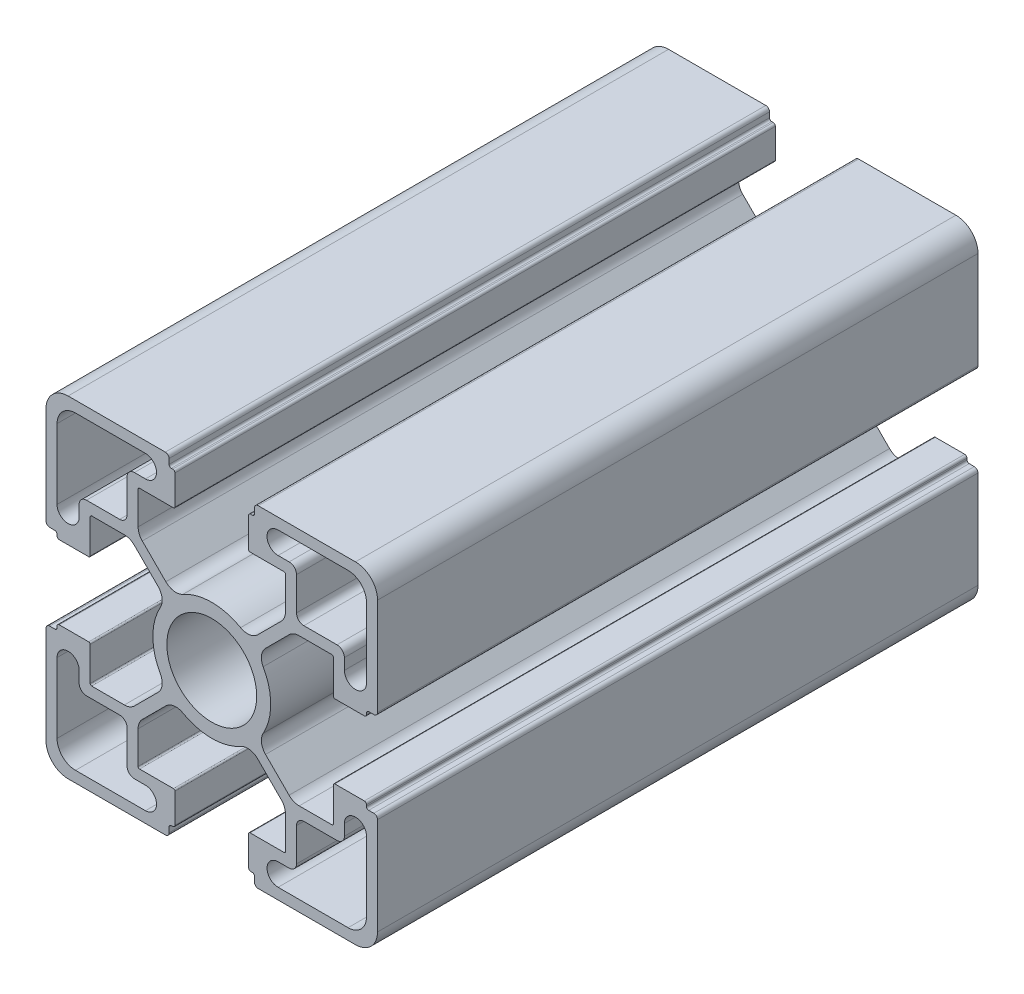
from build123d import *

# Parameters (mm, degrees)
BOSS_EXTRUDE1_DEPTH = 81.495816185
SCALE1_SCALE        = 0.5644444


with BuildPart() as part:
    # Sketch1 → Boss-Extrude1 (new body)
    with BuildSketch(Plane.XY):
        with BuildLine():
            Line((-22.5, 19.5), (-22.5, 6.3))
            ThreePointArc((-22.5, 6.3), (-22.353553391, 5.946446609), (-22, 5.8))
            Line((-22, 5.8), (-21.3, 5.8))
            ThreePointArc((-21.3, 5.8), (-21.087867966, 5.712132034), (-21, 5.5))
            Line((-21, 5.5), (-21, 5.3))
            ThreePointArc((-21, 5.3), (-20.912132034, 5.087867966), (-20.7, 5))
            Line((-20.7, 5), (-16.7, 5))
            ThreePointArc((-16.7, 5), (-16.558578644, 5.058578644), (-16.5, 5.2))
            Line((-16.5, 5.2), (-16.5, 9.8))
            ThreePointArc((-16.5, 9.8), (-16.441421356, 9.941421356), (-16.3, 10))
            Line((-16.3, 10), (-11.864234483, 10))
            ThreePointArc((-11.864234483, 10), (-11.121828624, 9.852326293), (-10.492447327, 9.431787156))
            Line((-10.492447327, 9.431787156), (-7.296699127, 6.236038955))
            ThreePointArc((-7.296699127, 6.236038955), (-6.746669172, 5.129240469), (-6.976648919, 3.914890784))
            ThreePointArc((-6.976648919, 3.914890784), (-7.739935121, 2.023216331), (-8, 0))
            ThreePointArc((-8, 0), (-7.739935121, -2.023216331), (-6.976648919, -3.914890784))
            ThreePointArc((-6.976648919, -3.914890784), (-6.746669172, -5.129240469), (-7.296699127, -6.236038955))
            Line((-7.296699127, -6.236038955), (-10.492447327, -9.431787156))
            ThreePointArc((-10.492447327, -9.431787156), (-11.121828624, -9.852326293), (-11.864234483, -10))
            Line((-11.864234483, -10), (-16.3, -10))
            ThreePointArc((-16.3, -10), (-16.441421356, -9.941421356), (-16.5, -9.8))
            Line((-16.5, -9.8), (-16.5, -5.2))
            ThreePointArc((-16.5, -5.2), (-16.558578644, -5.058578644), (-16.7, -5))
            Line((-16.7, -5), (-20.7, -5))
            ThreePointArc((-20.7, -5), (-20.912132034, -5.087867966), (-21, -5.3))
            Line((-21, -5.3), (-21, -5.5))
            ThreePointArc((-21, -5.5), (-21.087867966, -5.712132034), (-21.3, -5.8))
            Line((-21.3, -5.8), (-22, -5.8))
            ThreePointArc((-22, -5.8), (-22.353553391, -5.946446609), (-22.5, -6.3))
            Line((-22.5, -6.3), (-22.5, -19.5))
            ThreePointArc((-22.5, -19.5), (-21.621320344, -21.621320344), (-19.5, -22.5))
            Line((-19.5, -22.5), (-6.3, -22.5))
            ThreePointArc((-6.3, -22.5), (-5.946446609, -22.353553391), (-5.8, -22))
            Line((-5.8, -22), (-5.8, -21.3))
            ThreePointArc((-5.8, -21.3), (-5.712132034, -21.087867966), (-5.5, -21))
            Line((-5.5, -21), (-5.3, -21))
            ThreePointArc((-5.3, -21), (-5.087867966, -20.912132034), (-5, -20.7))
            Line((-5, -20.7), (-5, -16.7))
            ThreePointArc((-5, -16.7), (-5.058578644, -16.558578644), (-5.2, -16.5))
            Line((-5.2, -16.5), (-9.8, -16.5))
            ThreePointArc((-9.8, -16.5), (-9.941421356, -16.441421356), (-10, -16.3))
            Line((-10, -16.3), (-10, -11.864234483))
            ThreePointArc((-10, -11.864234483), (-9.852326293, -11.121828624), (-9.431787156, -10.492447327))
            Line((-9.431787156, -10.492447327), (-6.236038955, -7.296699127))
            ThreePointArc((-6.236038955, -7.296699127), (-5.129240469, -6.746669172), (-3.914890784, -6.976648919))
            ThreePointArc((-3.914890784, -6.976648919), (-2.023216331, -7.739935121), (0, -8))
            ThreePointArc((0, -8), (2.023216331, -7.739935121), (3.914890784, -6.976648919))
            ThreePointArc((3.914890784, -6.976648919), (5.129240469, -6.746669172), (6.236038955, -7.296699127))
            Line((6.236038955, -7.296699127), (9.431787156, -10.492447327))
            ThreePointArc((9.431787156, -10.492447327), (9.852326293, -11.121828624), (10, -11.864234483))
            Line((10, -11.864234483), (10, -16.3))
            ThreePointArc((10, -16.3), (9.941421356, -16.441421356), (9.8, -16.5))
            Line((9.8, -16.5), (5.2, -16.5))
            ThreePointArc((5.2, -16.5), (5.058578644, -16.558578644), (5, -16.7))
            Line((5, -16.7), (5, -20.7))
            ThreePointArc((5, -20.7), (5.087867966, -20.912132034), (5.3, -21))
            Line((5.3, -21), (5.5, -21))
            ThreePointArc((5.5, -21), (5.712132034, -21.087867966), (5.8, -21.3))
            Line((5.8, -21.3), (5.8, -22))
            ThreePointArc((5.8, -22), (5.946446609, -22.353553391), (6.3, -22.5))
            Line((6.3, -22.5), (19.5, -22.5))
            ThreePointArc((19.5, -22.5), (21.621320344, -21.621320344), (22.5, -19.5))
            Line((22.5, -19.5), (22.5, -6.3))
            ThreePointArc((22.5, -6.3), (22.353553391, -5.946446609), (22, -5.8))
            Line((22, -5.8), (21.3, -5.8))
            ThreePointArc((21.3, -5.8), (21.087867966, -5.712132034), (21, -5.5))
            Line((21, -5.5), (21, -5.3))
            ThreePointArc((21, -5.3), (20.912132034, -5.087867966), (20.7, -5))
            Line((20.7, -5), (16.7, -5))
            ThreePointArc((16.7, -5), (16.558578644, -5.058578644), (16.5, -5.2))
            Line((16.5, -5.2), (16.5, -9.8))
            ThreePointArc((16.5, -9.8), (16.441421356, -9.941421356), (16.3, -10))
            Line((16.3, -10), (11.864234483, -10))
            ThreePointArc((11.864234483, -10), (11.121828624, -9.852326293), (10.492447327, -9.431787156))
            Line((10.492447327, -9.431787156), (7.296699127, -6.236038955))
            ThreePointArc((7.296699127, -6.236038955), (6.746669172, -5.129240469), (6.976648919, -3.914890784))
            ThreePointArc((6.976648919, -3.914890784), (7.739935121, -2.023216331), (8, 0))
            ThreePointArc((8, 0), (7.739935121, 2.023216331), (6.976648919, 3.914890784))
            ThreePointArc((6.976648919, 3.914890784), (6.746669172, 5.129240469), (7.296699127, 6.236038955))
            Line((7.296699127, 6.236038955), (10.492447327, 9.431787156))
            ThreePointArc((10.492447327, 9.431787156), (11.121828624, 9.852326293), (11.864234483, 10))
            Line((11.864234483, 10), (16.3, 10))
            ThreePointArc((16.3, 10), (16.441421356, 9.941421356), (16.5, 9.8))
            Line((16.5, 9.8), (16.5, 5.2))
            ThreePointArc((16.5, 5.2), (16.558578644, 5.058578644), (16.7, 5))
            Line((16.7, 5), (20.7, 5))
            ThreePointArc((20.7, 5), (20.912132034, 5.087867966), (21, 5.3))
            Line((21, 5.3), (21, 5.5))
            ThreePointArc((21, 5.5), (21.087867966, 5.712132034), (21.3, 5.8))
            Line((21.3, 5.8), (22, 5.8))
            ThreePointArc((22, 5.8), (22.353553391, 5.946446609), (22.5, 6.3))
            Line((22.5, 6.3), (22.5, 19.5))
            ThreePointArc((22.5, 19.5), (21.621320344, 21.621320344), (19.5, 22.5))
            Line((19.5, 22.5), (6.3, 22.5))
            ThreePointArc((6.3, 22.5), (5.946446609, 22.353553391), (5.8, 22))
            Line((5.8, 22), (5.8, 21.3))
            ThreePointArc((5.8, 21.3), (5.712132034, 21.087867966), (5.5, 21))
            Line((5.5, 21), (5.3, 21))
            ThreePointArc((5.3, 21), (5.087867966, 20.912132034), (5, 20.7))
            Line((5, 20.7), (5, 16.7))
            ThreePointArc((5, 16.7), (5.058578644, 16.558578644), (5.2, 16.5))
            Line((5.2, 16.5), (9.8, 16.5))
            ThreePointArc((9.8, 16.5), (9.941421356, 16.441421356), (10, 16.3))
            Line((10, 16.3), (10, 11.864234483))
            ThreePointArc((10, 11.864234483), (9.852326293, 11.121828624), (9.431787156, 10.492447327))
            Line((9.431787156, 10.492447327), (6.236038955, 7.296699127))
            ThreePointArc((6.236038955, 7.296699127), (5.129240469, 6.746669172), (3.914890784, 6.976648919))
            ThreePointArc((3.914890784, 6.976648919), (2.023216331, 7.739935121), (0, 8))
            ThreePointArc((0, 8), (-2.023216331, 7.739935121), (-3.914890784, 6.976648919))
            ThreePointArc((-3.914890784, 6.976648919), (-5.129240469, 6.746669172), (-6.236038955, 7.296699127))
            Line((-6.236038955, 7.296699127), (-9.431787156, 10.492447327))
            ThreePointArc((-9.431787156, 10.492447327), (-9.852326293, 11.121828624), (-10, 11.864234483))
            Line((-10, 11.864234483), (-10, 16.3))
            ThreePointArc((-10, 16.3), (-9.941421356, 16.441421356), (-9.8, 16.5))
            Line((-9.8, 16.5), (-5.2, 16.5))
            ThreePointArc((-5.2, 16.5), (-5.058578644, 16.558578644), (-5, 16.7))
            Line((-5, 16.7), (-5, 20.7))
            ThreePointArc((-5, 20.7), (-5.087867966, 20.912132034), (-5.3, 21))
            Line((-5.3, 21), (-5.5, 21))
            ThreePointArc((-5.5, 21), (-5.712132034, 21.087867966), (-5.8, 21.3))
            Line((-5.8, 21.3), (-5.8, 22))
            ThreePointArc((-5.8, 22), (-5.946446609, 22.353553391), (-6.3, 22.5))
            Line((-6.3, 22.5), (-19.5, 22.5))
            ThreePointArc((-19.5, 22.5), (-21.621320344, 21.621320344), (-22.5, 19.5))
        make_face()
        with BuildLine():
            Line((-21, 18.5), (-21, 9))
            ThreePointArc((-21, 9), (-19.5, 7.5), (-18, 9))
            Line((-18, 9), (-18, 10.5))
            ThreePointArc((-18, 10.5), (-17.707106781, 11.207106781), (-17, 11.5))
            Line((-17, 11.5), (-12.5, 11.5))
            ThreePointArc((-12.5, 11.5), (-11.792893219, 11.792893219), (-11.5, 12.5))
            Line((-11.5, 12.5), (-11.5, 17))
            ThreePointArc((-11.5, 17), (-11.207106781, 17.707106781), (-10.5, 18))
            Line((-10.5, 18), (-9, 18))
            ThreePointArc((-9, 18), (-7.5, 19.5), (-9, 21))
            Line((-9, 21), (-18.5, 21))
            ThreePointArc((-18.5, 21), (-20.267766953, 20.267766953), (-21, 18.5))
        make_face(mode=Mode.SUBTRACT)
        with BuildLine():
            Line((18.5, 21), (9, 21))
            ThreePointArc((9, 21), (7.5, 19.5), (9, 18))
            Line((9, 18), (10.5, 18))
            ThreePointArc((10.5, 18), (11.207106781, 17.707106781), (11.5, 17))
            Line((11.5, 17), (11.5, 12.5))
            ThreePointArc((11.5, 12.5), (11.792893219, 11.792893219), (12.5, 11.5))
            Line((12.5, 11.5), (17, 11.5))
            ThreePointArc((17, 11.5), (17.707106781, 11.207106781), (18, 10.5))
            Line((18, 10.5), (18, 9))
            ThreePointArc((18, 9), (19.5, 7.5), (21, 9))
            Line((21, 9), (21, 18.5))
            ThreePointArc((21, 18.5), (20.267766953, 20.267766953), (18.5, 21))
        make_face(mode=Mode.SUBTRACT)
        with BuildLine():
            Line((21, -18.5), (21, -9))
            ThreePointArc((21, -9), (19.5, -7.5), (18, -9))
            Line((18, -9), (18, -10.5))
            ThreePointArc((18, -10.5), (17.707106781, -11.207106781), (17, -11.5))
            Line((17, -11.5), (12.5, -11.5))
            ThreePointArc((12.5, -11.5), (11.792893219, -11.792893219), (11.5, -12.5))
            Line((11.5, -12.5), (11.5, -17))
            ThreePointArc((11.5, -17), (11.207106781, -17.707106781), (10.5, -18))
            Line((10.5, -18), (9, -18))
            ThreePointArc((9, -18), (7.5, -19.5), (9, -21))
            Line((9, -21), (18.5, -21))
            ThreePointArc((18.5, -21), (20.267766953, -20.267766953), (21, -18.5))
        make_face(mode=Mode.SUBTRACT)
        with BuildLine():
            Line((-18.5, -21), (-9, -21))
            ThreePointArc((-9, -21), (-7.5, -19.5), (-9, -18))
            Line((-9, -18), (-10.5, -18))
            ThreePointArc((-10.5, -18), (-11.207106781, -17.707106781), (-11.5, -17))
            Line((-11.5, -17), (-11.5, -12.5))
            ThreePointArc((-11.5, -12.5), (-11.792893219, -11.792893219), (-12.5, -11.5))
            Line((-12.5, -11.5), (-17, -11.5))
            ThreePointArc((-17, -11.5), (-17.707106781, -11.207106781), (-18, -10.5))
            Line((-18, -10.5), (-18, -9))
            ThreePointArc((-18, -9), (-19.5, -7.5), (-21, -9))
            Line((-21, -9), (-21, -18.5))
            ThreePointArc((-21, -18.5), (-20.267766953, -20.267766953), (-18.5, -21))
        make_face(mode=Mode.SUBTRACT)
        with BuildLine():
            ThreePointArc((0, 6.1), (-4.313351365, 4.313351365), (-6.1, 0))
            ThreePointArc((-6.1, 0), (-4.313351365, -4.313351365), (0, -6.1))
            ThreePointArc((0, -6.1), (4.313351365, -4.313351365), (6.1, 0))
            ThreePointArc((6.1, 0), (4.313351365, 4.313351365), (0, 6.1))
        make_face(mode=Mode.SUBTRACT)
    extrude(amount=BOSS_EXTRUDE1_DEPTH)


with BuildPart() as part_1:
    # Scale1: scaled about (0, 0, 40.747908092)
    add(part.part.scale(SCALE1_SCALE).moved(Location((0, 0, 17.747979558))))


solid = part_1.part
